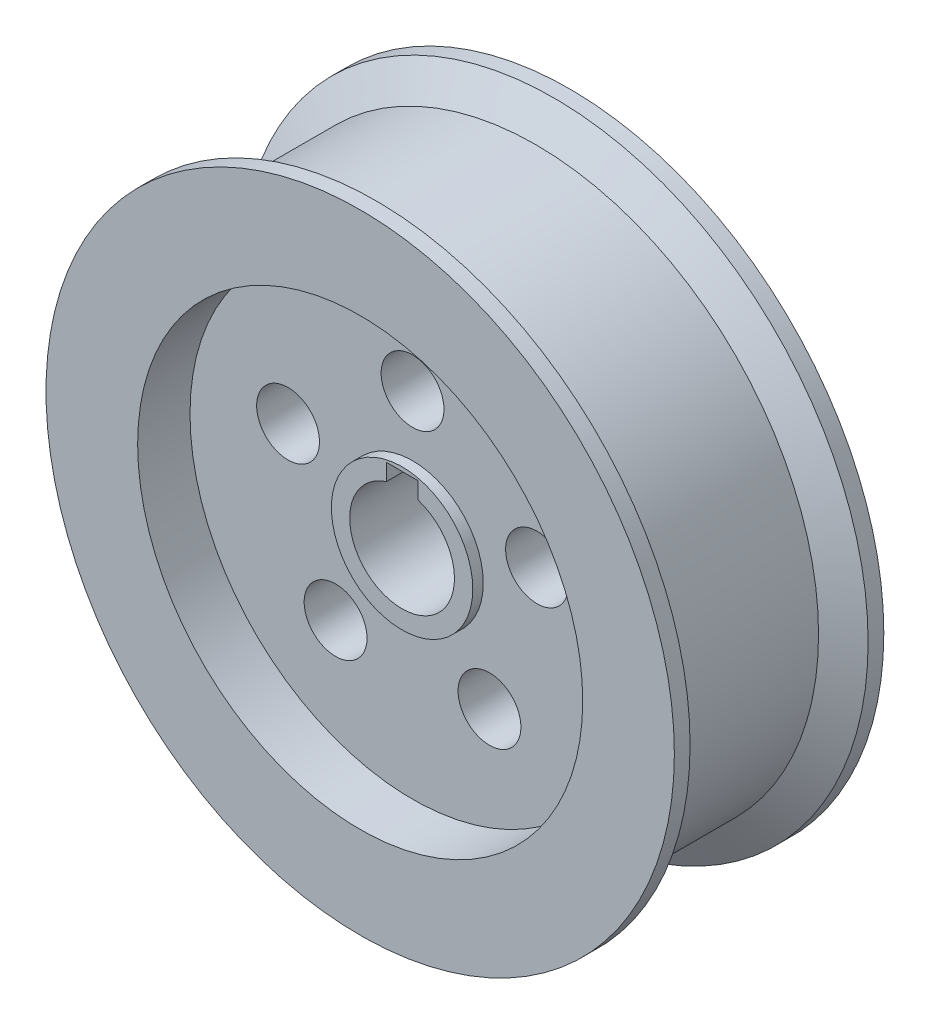
from build123d import *

# Parameters (mm, degrees)
SKETCH2_R                = 60
SKETCH2_R_2              = 10
BOSS_EXTRUDE1_DEPTH      = 20
SKETCH3_R                = 42.5
CUT_EXTRUDE1_DEPTH       = 10
SKETCH4_R                = 6
CUT_EXTRUDE2_DEPTH       = 91
CIRPATTERN2_COUNT        = 5
BOSS_EXTRUDE3_DEPTH      = 2
BOSS_EXTRUDE3_DEPTH_BACK = 7
SKETCH6_R                = 13.5
SKETCH6_R_2              = 10
CUT_EXTRUDE3_DEPTH       = 91
CUT_EXTRUDE3_DEPTH_BACK  = 91
SKETCH8_W                = 6
SKETCH8_H                = 3.21


with BuildPart() as part:
    # Sketch2 → Boss-Extrude1 (new, symmetric)
    with BuildSketch(Plane.XY):
        Circle(SKETCH2_R)
        Circle(SKETCH2_R_2, mode=Mode.SUBTRACT)
    extrude(amount=BOSS_EXTRUDE1_DEPTH, both=True)

    # Sketch3 → Cut-Extrude1 (cut)
    with BuildSketch(Plane.XY.offset(20)):
        Circle(SKETCH3_R)
    cut_extrude1 = extrude(amount=-CUT_EXTRUDE1_DEPTH, mode=Mode.SUBTRACT)

    # Mirror2: Cut-Extrude1 across plane
    add(cut_extrude1.mirror(Plane.XY), mode=Mode.SUBTRACT)

    # Sketch4 → Cut-Extrude2 (cut, symmetric)
    with BuildSketch(Plane.XY.offset(10)):
        with Locations((0, 25)):
            Circle(SKETCH4_R)
    cut_extrude2 = extrude(amount=CUT_EXTRUDE2_DEPTH, both=True, mode=Mode.SUBTRACT)

    # CirPattern2: Cut-Extrude2 ×5 about axis
    cirpattern2_axis = Axis((0, 0, 0), (0, 0, 1))
    for i in range(1, CIRPATTERN2_COUNT):
        add(cut_extrude2.rotate(cirpattern2_axis, i * 360 / CIRPATTERN2_COUNT), mode=Mode.SUBTRACT)

    # Sketch5 → Cut-Revolve1 (revolve, cut)
    with BuildSketch(Plane(origin=(0, 0, 0), x_dir=(1, 0, 0), z_dir=(0, 1, 0))):
        Polygon((54, 13.535898385), (60, 17), (60, -17), (54, -13.535898385), align=None)
    revolve(axis=Axis((0, 0, 0), (0, 0, -1)), mode=Mode.SUBTRACT)

    # Sketch6 → Boss-Extrude3 (add, two sides: drawn at the far end of the back side and taken through both)
    with BuildSketch(Plane.XY.offset(10).offset(-BOSS_EXTRUDE3_DEPTH_BACK)):
        Circle(SKETCH6_R)
        with Locations(Location((0, 0, 0), (0, 0, 180))):
            Circle(SKETCH6_R_2, mode=Mode.SUBTRACT)
    extrude(amount=BOSS_EXTRUDE3_DEPTH + BOSS_EXTRUDE3_DEPTH_BACK)

    # Sketch8 → Cut-Extrude3 (cut, two sides: drawn at the far end of the back side and taken through both)
    with BuildSketch(Plane(origin=(0, 0, -10), x_dir=(-1, 0, 0), z_dir=(0, 0, -1)).offset(-CUT_EXTRUDE3_DEPTH_BACK)):
        with Locations((0, 11.121882551)):
            Rectangle(SKETCH8_W, SKETCH8_H)
    extrude(amount=CUT_EXTRUDE3_DEPTH + CUT_EXTRUDE3_DEPTH_BACK, mode=Mode.SUBTRACT)


solid = part.part
